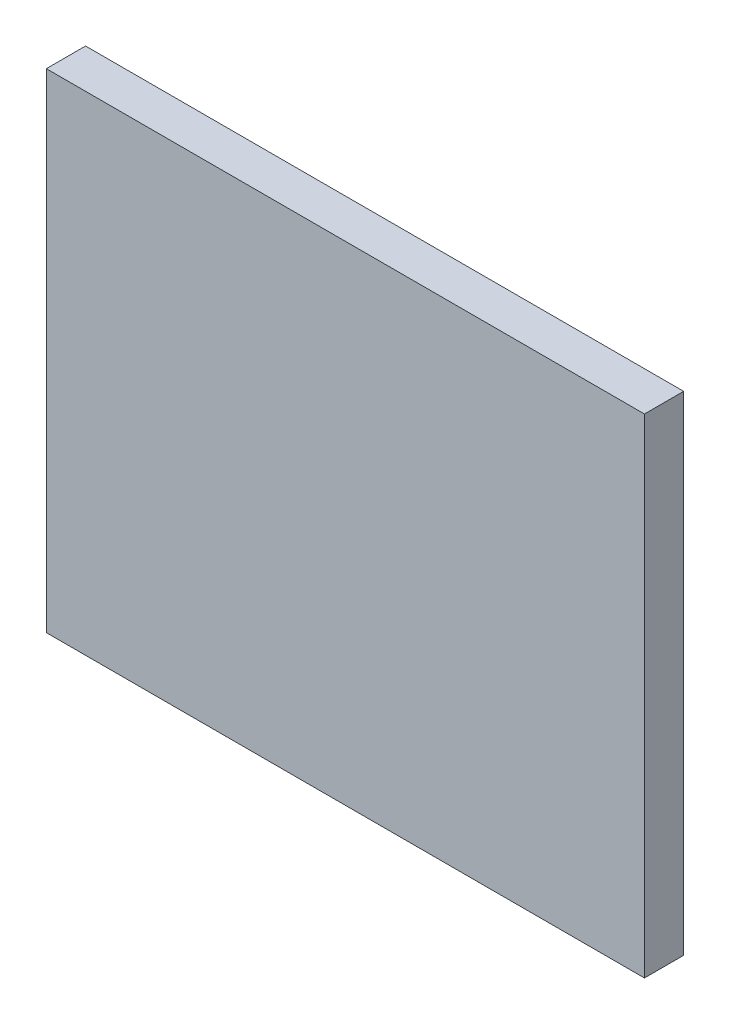
from build123d import *

# Parameters (mm, degrees)
SKIZZE1_W               = 15.24
SKIZZE1_H               = 12.446
COMPONENT_OUTLINE_DEPTH = 1


with BuildPart() as part:
    # Skizze1 → Component_Outline (new body)
    with BuildSketch(Plane.XY):
        with Locations((0, 4.699)):
            Rectangle(SKIZZE1_W, SKIZZE1_H)
    extrude(amount=COMPONENT_OUTLINE_DEPTH)


solid = part.part
